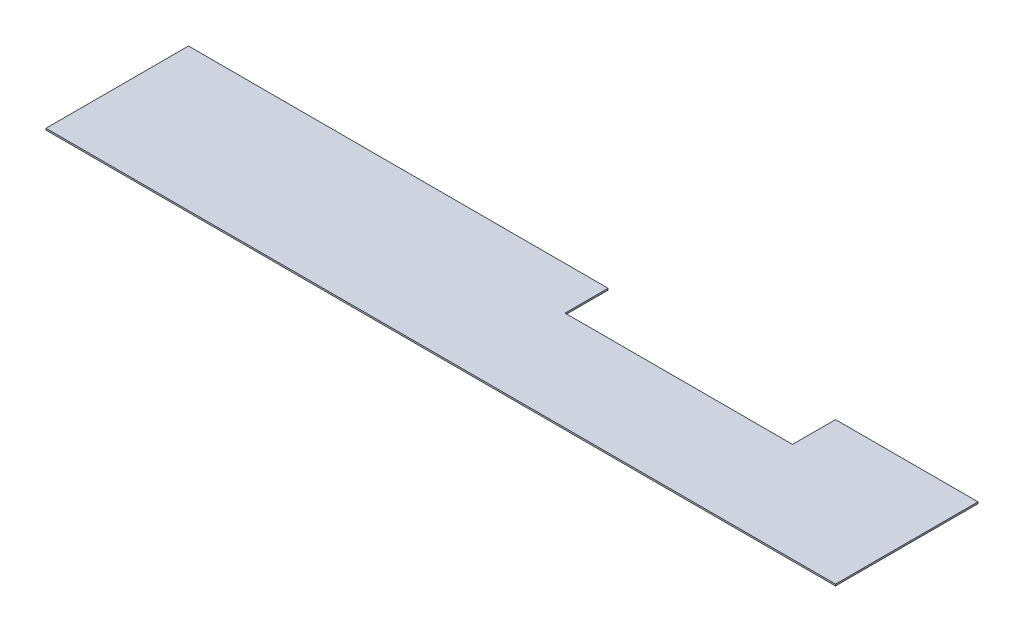
from build123d import *

# Parameters (mm, degrees)
SKETCH1_W           = 1524
SKETCH1_H           = 275
BOSS_EXTRUDE1_DEPTH = 3.175
CUT_EXTRUDE1_REACH  = 776.313
SKETCH2_W           = 439
SKETCH2_H           = 83


with BuildPart() as part:
    # Sketch1 → Boss-Extrude1 (new body)
    with BuildSketch(Plane(origin=(0, 0, 0), x_dir=(1, 0, 0), z_dir=(0, 1, 0))):
        Rectangle(SKETCH1_W, SKETCH1_H)
    extrude(amount=BOSS_EXTRUDE1_DEPTH)

    # Sketch2 → Cut-Extrude1 (cut, up to next)
    with BuildSketch(Plane.XZ, mode=Mode.PRIVATE) as cut_extrude1_sk1:
        with Locations((267.5, -96)):
            Rectangle(SKETCH2_W, SKETCH2_H)
    cut_extrude1_tool1 = extrude(cut_extrude1_sk1.sketch, amount=-CUT_EXTRUDE1_REACH, mode=Mode.PRIVATE) & part.part
    add(cut_extrude1_tool1.solids().sort_by_distance((267.5, 0, -96))[0], mode=Mode.SUBTRACT)


solid = part.part
